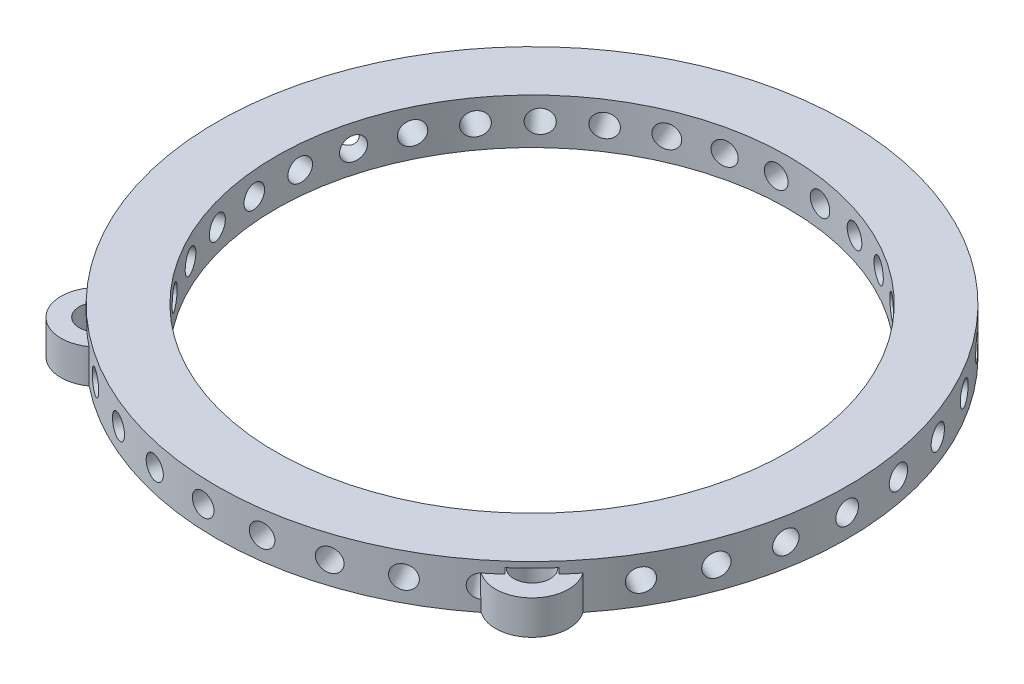
from build123d import *

# Parameters (mm, degrees)
CORTAR_EXTRUIR1_REACH      = 64.068
CORTAR_EXTRUIR1_END_RADIUS = 22.5
CROQUIS3_R                 = 1
MATRIZC1_COUNT             = 35
CROQUIS5_R                 = 1.8
CORTAR_EXTRUIR2_DEPTH      = 3.5
CROQUIS6_R                 = 3.2
CROQUIS6_R_2               = 1.6
SALIENTE_EXTRUIR1_DEPTH    = 3


with BuildPart() as part:
    # Croquis2 → Revolución1 (revolve)
    with BuildSketch(Plane.XY, mode=Mode.PRIVATE) as revoluci_n1_sk:
        Polygon((-22.5, 0), (-22.5, 1), (-22.5, 4), (-27.7, 4), (-27.7, 0), align=None)
    revolve(revoluci_n1_sk.sketch.rotate(Axis((0, 0, 0), (0, 1, 0)), 270), axis=Axis((0, 0, 0), (0, 1, 0)))

    # Cortar-Extruir1: up to this cylinder (the profile starts outside it)
    cortar_extruir1_end = Plane(origin=(0, 2, 0), z_dir=(0, -1, 0)) * Cylinder(CORTAR_EXTRUIR1_END_RADIUS, 174.136, mode=Mode.PRIVATE)
    # Croquis3 → Cortar-Extruir1 (cut, up to the surface)
    with BuildSketch(Plane(origin=(27.7, 0, 0), x_dir=(0, 0, -1), z_dir=(1, 0, 0)), mode=Mode.PRIVATE) as cortar_extruir1_sk1:
        with Locations((0, 2)):
            Circle(CROQUIS3_R)
    cortar_extruir1_tool1 = extrude(cortar_extruir1_sk1.sketch, amount=-CORTAR_EXTRUIR1_REACH, mode=Mode.PRIVATE) - cortar_extruir1_end
    cortar_extruir1 = cortar_extruir1_tool1.solids().sort_by_distance((27.7, 2, 0))[0]
    add(cortar_extruir1, mode=Mode.SUBTRACT)

    # MatrizC1: Cortar-Extruir1 ×35 about axis
    matrizc1_axis = Axis((0, 0, 0), (0, -1, 0))
    for i in range(1, MATRIZC1_COUNT):
        add(cortar_extruir1.rotate(matrizc1_axis, i * 360 / MATRIZC1_COUNT), mode=Mode.SUBTRACT)

    # Croquis5 → Cortar-Extruir2 (cut)
    with BuildSketch(Plane.XZ):
        with Locations(Location((0, -25.1, 0), (0, 0, 270))):
            Circle(CROQUIS5_R)
        with Locations(Location((-23.586284782, -8.584705597, 0), (0, 0, 270))):
            Circle(CROQUIS5_R)
        with Locations((-19.091883092, 19.091883092)):
            Circle(CROQUIS5_R)
        with Locations((19.091883092, 19.091883092)):
            Circle(CROQUIS5_R)
        with Locations(Location((23.586284782, -8.584705597, 0), (0, 0, 90))):
            Circle(CROQUIS5_R)
    extrude(amount=-CORTAR_EXTRUIR2_DEPTH, mode=Mode.SUBTRACT)

    # Croquis6 → Saliente-Extruir1 (add)
    # profile 1 of 2: a face of its own
    with BuildSketch(Plane.XZ):
        with Locations((-19.091883092, 19.091883092)):
            Circle(CROQUIS6_R)
        with Locations(Location((-19.091883092, 19.091883092, 0), (0, 0, 270))):
            Circle(CROQUIS6_R_2, mode=Mode.SUBTRACT)
    # profile 2 of 2: a face of its own
    with BuildSketch(Plane.XZ):
        with Locations((19.091883092, 19.091883092)):
            Circle(CROQUIS6_R)
        with Locations(Location((19.091883092, 19.091883092, 0), (0, 0, 90))):
            Circle(CROQUIS6_R_2, mode=Mode.SUBTRACT)
    extrude(amount=-SALIENTE_EXTRUIR1_DEPTH)


solid = part.part
